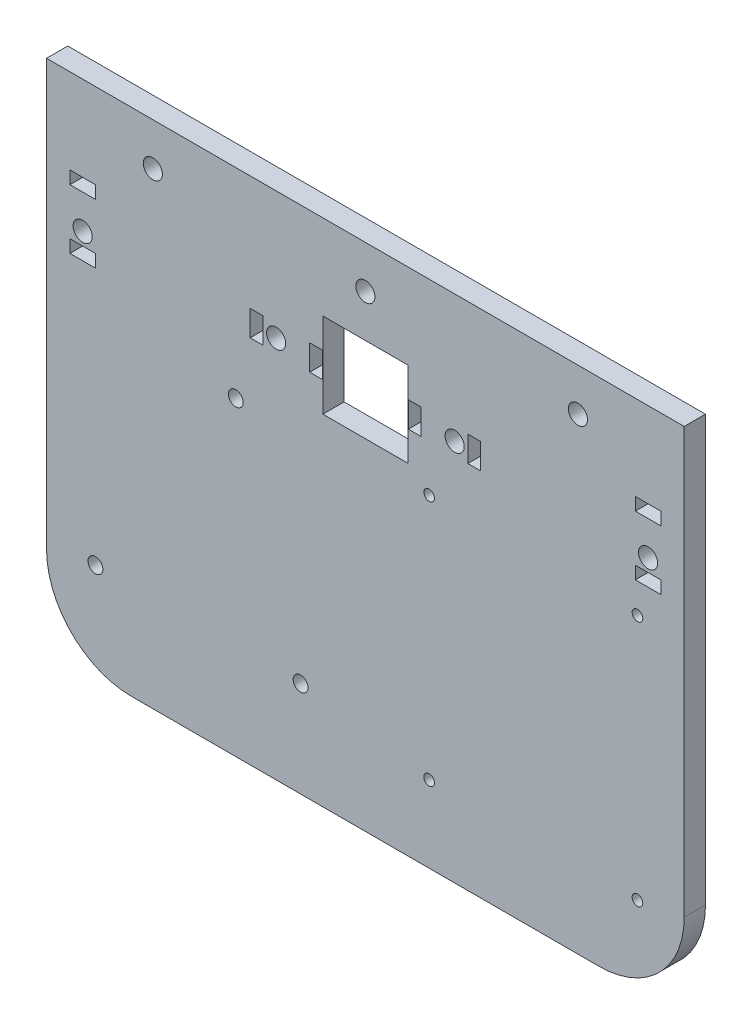
from build123d import *

# Parameters (mm, degrees)
ESQUISSE1_R        = 1.25
ESQUISSE1_R_2      = 2.25
ESQUISSE1_R_3      = 1.75
ESQUISSE1_W        = 20
ESQUISSE1_H        = 20
ESQUISSE1_W_2      = 6
ESQUISSE1_H_2      = 3
ESQUISSE1_W_3      = 3
ESQUISSE1_H_3      = 6
BOSS_EXTRU_1_DEPTH = 5


with BuildPart() as part:
    # Esquisse1 → Boss.-Extru.1 (new body)
    with BuildSketch(Plane.XY):
        with BuildLine():
            Line((0, 0), (150, 0))
            Line((150, 0), (150, -100))
            ThreePointArc((150, -100), (144.142135624, -114.142135624), (130, -120))
            Line((130, -120), (20, -120))
            ThreePointArc((20, -120), (5.857864376, -114.142135624), (0, -100))
            Line((0, -100), (0, 0))
        make_face()
        with Locations((90, -44)):
            Circle(ESQUISSE1_R, mode=Mode.SUBTRACT)
        with Locations((139, -44)):
            Circle(ESQUISSE1_R, mode=Mode.SUBTRACT)
        with Locations((139, -102)):
            Circle(ESQUISSE1_R, mode=Mode.SUBTRACT)
        with Locations((90, -102)):
            Circle(ESQUISSE1_R, mode=Mode.SUBTRACT)
        with Locations((8.5, -31)):
            Circle(ESQUISSE1_R_2, mode=Mode.SUBTRACT)
        with Locations((141.5, -31)):
            Circle(ESQUISSE1_R_2, mode=Mode.SUBTRACT)
        with Locations((25, -10)):
            Circle(ESQUISSE1_R_2, mode=Mode.SUBTRACT)
        with Locations((125, -10)):
            Circle(ESQUISSE1_R_2, mode=Mode.SUBTRACT)
        with Locations((96, -30)):
            Circle(ESQUISSE1_R_2, mode=Mode.SUBTRACT)
        with Locations((54, -30)):
            Circle(ESQUISSE1_R_2, mode=Mode.SUBTRACT)
        with Locations((75, -10)):
            Circle(ESQUISSE1_R_2, mode=Mode.SUBTRACT)
        with Locations((11.5, -97.5)):
            Circle(ESQUISSE1_R_3, mode=Mode.SUBTRACT)
        with Locations((59.76, -97.5)):
            Circle(ESQUISSE1_R_3, mode=Mode.SUBTRACT)
        with Locations((44.52, -47)):
            Circle(ESQUISSE1_R_3, mode=Mode.SUBTRACT)
        with Locations((75, -30)):
            Rectangle(ESQUISSE1_W, ESQUISSE1_H, mode=Mode.SUBTRACT)
        with Locations((8.5, -35.5)):
            Rectangle(ESQUISSE1_W_2, ESQUISSE1_H_2, mode=Mode.SUBTRACT)
        with Locations((8.5, -21.5)):
            Rectangle(ESQUISSE1_W_2, ESQUISSE1_H_2, mode=Mode.SUBTRACT)
        with Locations((141.5, -35.5)):
            Rectangle(ESQUISSE1_W_2, ESQUISSE1_H_2, mode=Mode.SUBTRACT)
        with Locations((141.5, -21.5)):
            Rectangle(ESQUISSE1_W_2, ESQUISSE1_H_2, mode=Mode.SUBTRACT)
        with Locations((100.6, -30)):
            Rectangle(ESQUISSE1_W_3, ESQUISSE1_H_3, mode=Mode.SUBTRACT)
        with Locations((86.6, -30)):
            Rectangle(ESQUISSE1_W_3, ESQUISSE1_H_3, mode=Mode.SUBTRACT)
        with Locations((49.4, -30)):
            Rectangle(ESQUISSE1_W_3, ESQUISSE1_H_3, mode=Mode.SUBTRACT)
        with Locations((63.4, -30)):
            Rectangle(ESQUISSE1_W_3, ESQUISSE1_H_3, mode=Mode.SUBTRACT)
    extrude(amount=BOSS_EXTRU_1_DEPTH)


solid = part.part
